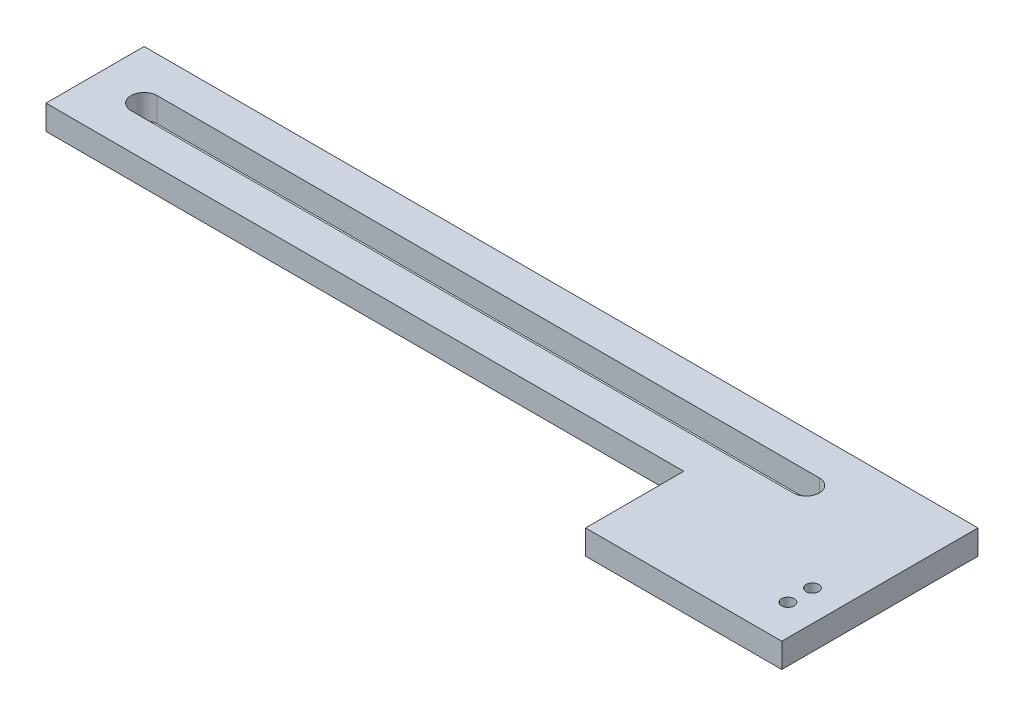
from build123d import *

# Parameters (mm, degrees)
BOSS_EXTRUDE1_DEPTH                            = 6.35
CUT_EXTRUDE1_DEPTH                             = 222.886846163
CSK_FOR_4_FLAT_HEAD_MACHINE_SCREW1_D           = 3.2639
CSK_FOR_4_FLAT_HEAD_MACHINE_SCREW1_CSINK_D     = 5.715
CSK_FOR_4_FLAT_HEAD_MACHINE_SCREW1_CSINK_ANGLE = 82


with BuildPart() as part:
    # Sketch1 → Boss-Extrude1 (new body)
    with BuildSketch(Plane(origin=(0, 0, 0), x_dir=(1, 0, 0), z_dir=(0, 1, 0))):
        Polygon((0, 0), (215.9, 0), (215.9, -50.8), (165.1, -50.8), (165.1, -25.4), (0, -25.4), align=None)
    extrude(amount=BOSS_EXTRUDE1_DEPTH)

    # Sketch2 → Cut-Extrude1 (cut, through all)
    with BuildSketch(Plane(origin=(0, 6.35, 0), x_dir=(1, 0, 0), z_dir=(0, 1, 0))):
        with BuildLine():
            Line((184.15, -16.0782), (12.7, -16.0782))
            ThreePointArc((12.7, -16.0782), (9.3218, -12.7), (12.7, -9.3218))
            Line((12.7, -9.3218), (184.15, -9.3218))
            ThreePointArc((184.15, -9.3218), (187.5282, -12.7), (184.15, -16.0782))
        make_face()
    extrude(amount=-CUT_EXTRUDE1_DEPTH, mode=Mode.SUBTRACT)

    # CSK for #4 Flat Head Machine Screw1 (through all)
    with Locations(Plane(origin=(0, 0, 0), x_dir=(-1, 0, 0), z_dir=(0, -1, 0))):
        with Locations((-207.9625, -34.925), (-207.9625, -41.275)):
            CounterSinkHole(CSK_FOR_4_FLAT_HEAD_MACHINE_SCREW1_D / 2, CSK_FOR_4_FLAT_HEAD_MACHINE_SCREW1_CSINK_D / 2, counter_sink_angle=CSK_FOR_4_FLAT_HEAD_MACHINE_SCREW1_CSINK_ANGLE)


solid = part.part
